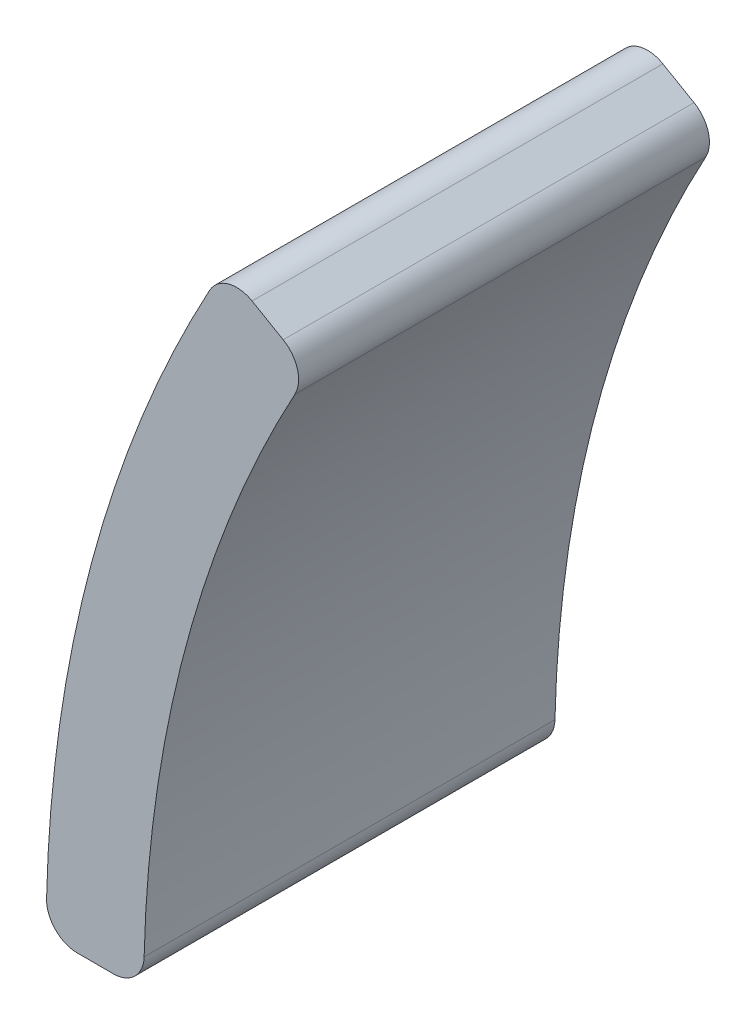
from build123d import *

# Parameters (mm, degrees)
EXTRUDE_1_DEPTH     = 40
FILLET_1_R          = 3
SKETCH_2_R          = 2
CUT_EXTRUDE_1_DEPTH = 10


with BuildPart() as part:
    # 草图1 → 凸台-拉伸1 (new body)
    with BuildSketch(Plane.XY):
        with BuildLine():
            Line((-130, 0), (-120.5, 0))
            ThreePointArc((-120.5, 0), (-116.394062068, 31.187694935), (-104.356061156, 60.25))
            Line((-104.356061156, 60.25), (-112.583302492, 65))
            ThreePointArc((-112.583302492, 65), (-125.570357418, 33.646475863), (-130, 0))
        make_face()
    extrude(amount=EXTRUDE_1_DEPTH)

    # 圆角1
    fillet_1_edges = [part.edges().sort_by_distance(p)[0] for p in [
        (-104.356061156, 60.25, 20),
        (-120.5, 0, 20),
        (-130, 0, 20),
        (-112.583302492, 65, 20),
    ]]
    fillet(fillet_1_edges, radius=FILLET_1_R)

    # 草图2 → 切除-拉伸1 (cut)
    with BuildSketch(Plane(origin=(0, 0, 0), x_dir=(-1, 0, 0), z_dir=(0, 0, -1))):
        with Locations((125.022434611, 10.938045715)):
            Circle(SKETCH_2_R)
        with Locations((113.741627273, 53.038591848)):
            Circle(SKETCH_2_R)
    extrude(amount=-CUT_EXTRUDE_1_DEPTH, mode=Mode.SUBTRACT)


solid = part.part
